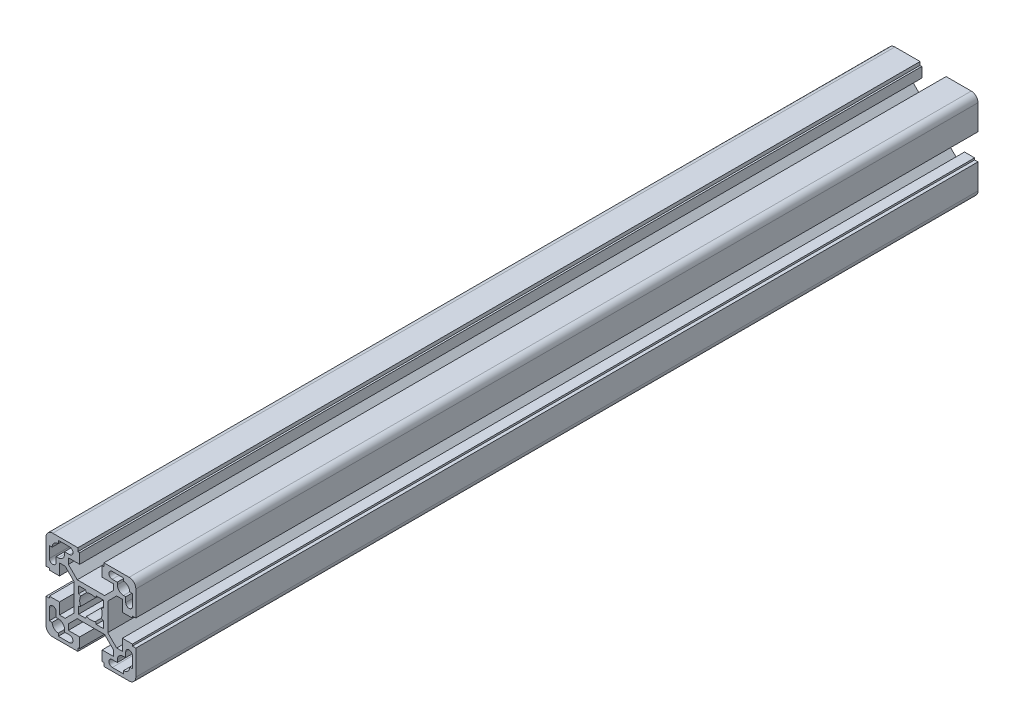
from build123d import *

# Parameters (mm, degrees)
EXTRUDE1_DEPTH = 375


with BuildPart() as part:
    # Sketch1 → Extrude1 (new body)
    with BuildSketch(Plane.XY):
        with BuildLine():
            Line((5.8, -20), (17, -20))
            ThreePointArc((17, -20), (19.121320344, -19.121320344), (20, -17))
            Line((20, -17), (20, -5.8))
            Line((20, -5.8), (18.5, -5.8))
            Line((18.5, -5.8), (18.5, -5))
            Line((18.5, -5), (14, -5))
            Line((14, -5), (14, -10.05))
            Line((14, -10.05), (11.464213562, -10.05))
            Line((11.464213562, -10.05), (7.5, -6.085786438))
            Line((7.5, -6.085786438), (7.5, 6.085786438))
            Line((7.5, 6.085786438), (11.464213562, 10.05))
            Line((11.464213562, 10.05), (14, 10.05))
            Line((14, 10.05), (14, 5))
            Line((14, 5), (18.5, 5))
            Line((18.5, 5), (18.5, 5.8))
            Line((18.5, 5.8), (20, 5.8))
            Line((20, 5.8), (20, 17))
            ThreePointArc((20, 17), (19.121320344, 19.121320344), (17, 20))
            Line((17, 20), (5.8, 20))
            Line((5.8, 20), (5.8, 18.5))
            Line((5.8, 18.5), (5, 18.5))
            Line((5, 18.5), (5, 14))
            Line((5, 14), (10.05, 14))
            Line((10.05, 14), (10.05, 11.464213562))
            Line((10.05, 11.464213562), (6.085786438, 7.5))
            Line((6.085786438, 7.5), (-6.085786438, 7.5))
            Line((-6.085786438, 7.5), (-10.05, 11.464213562))
            Line((-10.05, 11.464213562), (-10.05, 14))
            Line((-10.05, 14), (-5, 14))
            Line((-5, 14), (-5, 18.5))
            Line((-5, 18.5), (-5.8, 18.5))
            Line((-5.8, 18.5), (-5.8, 20))
            Line((-5.8, 20), (-17, 20))
            ThreePointArc((-17, 20), (-19.121320344, 19.121320344), (-20, 17))
            Line((-20, 17), (-20, 5.8))
            Line((-20, 5.8), (-18.5, 5.8))
            Line((-18.5, 5.8), (-18.5, 5))
            Line((-18.5, 5), (-14, 5))
            Line((-14, 5), (-14, 10.05))
            Line((-14, 10.05), (-11.464213562, 10.05))
            Line((-11.464213562, 10.05), (-7.5, 6.085786438))
            Line((-7.5, 6.085786438), (-7.5, -6.085786438))
            Line((-7.5, -6.085786438), (-11.464213562, -10.05))
            Line((-11.464213562, -10.05), (-14, -10.05))
            Line((-14, -10.05), (-14, -5))
            Line((-14, -5), (-18.5, -5))
            Line((-18.5, -5), (-18.5, -5.8))
            Line((-18.5, -5.8), (-20, -5.8))
            Line((-20, -5.8), (-20, -17))
            ThreePointArc((-20, -17), (-19.121320344, -19.121320344), (-17, -20))
            Line((-17, -20), (-5.8, -20))
            Line((-5.8, -20), (-5.8, -18.5))
            Line((-5.8, -18.5), (-5, -18.5))
            Line((-5, -18.5), (-5, -14))
            Line((-5, -14), (-10.05, -14))
            Line((-10.05, -14), (-10.05, -11.464213562))
            Line((-10.05, -11.464213562), (-6.085786438, -7.5))
            Line((-6.085786438, -7.5), (6.085786438, -7.5))
            Line((6.085786438, -7.5), (10.05, -11.464213562))
            Line((10.05, -11.464213562), (10.05, -14))
            Line((10.05, -14), (5, -14))
            Line((5, -14), (5, -18.5))
            Line((5, -18.5), (5.8, -18.5))
            Line((5.8, -18.5), (5.8, -20))
        make_face()
        with BuildLine():
            Line((14.5, -18.5), (9.5, -18.5))
            ThreePointArc((9.5, -18.5), (8, -17), (9.5, -15.5))
            Line((9.5, -15.5), (11.75, -15.5))
            Line((11.75, -15.5), (11.75, -14.5))
            ThreePointArc((11.75, -14.5), (12.555456352, -12.555456352), (14.5, -11.75))
            Line((14.5, -11.75), (15.5, -11.75))
            Line((15.5, -11.75), (15.5, -9.5))
            ThreePointArc((15.5, -9.5), (17, -8), (18.5, -9.5))
            Line((18.5, -9.5), (18.5, -14.5))
            Line((18.5, -14.5), (17.25, -14.5))
            ThreePointArc((17.25, -14.5), (16.444543648, -16.444543648), (14.5, -17.25))
            Line((14.5, -17.25), (14.5, -18.5))
        make_face(mode=Mode.SUBTRACT)
        with BuildLine():
            Line((18.5, 14.5), (17.25, 14.5))
            ThreePointArc((17.25, 14.5), (16.444543648, 16.444543648), (14.5, 17.25))
            Line((14.5, 17.25), (14.5, 18.5))
            Line((14.5, 18.5), (9.5, 18.5))
            ThreePointArc((9.5, 18.5), (8, 17), (9.5, 15.5))
            Line((9.5, 15.5), (11.75, 15.5))
            Line((11.75, 15.5), (11.75, 14.5))
            ThreePointArc((11.75, 14.5), (12.555456352, 12.555456352), (14.5, 11.75))
            Line((14.5, 11.75), (15.5, 11.75))
            Line((15.5, 11.75), (15.5, 9.5))
            ThreePointArc((15.5, 9.5), (17, 8), (18.5, 9.5))
            Line((18.5, 9.5), (18.5, 14.5))
        make_face(mode=Mode.SUBTRACT)
        with BuildLine():
            Line((5.5, 5.5), (2.397915762, 5.5))
            Line((2.397915762, 5.5), (1.998263135, 4.583333333))
            ThreePointArc((1.998263135, 4.583333333), (0, 5), (-1.998263135, 4.583333333))
            Line((-1.998263135, 4.583333333), (-2.397915762, 5.5))
            Line((-2.397915762, 5.5), (-5.5, 5.5))
            Line((-5.5, 5.5), (-5.5, 2.397915762))
            Line((-5.5, 2.397915762), (-4.583333333, 1.998263135))
            ThreePointArc((-4.583333333, 1.998263135), (-5, 0), (-4.583333333, -1.998263135))
            Line((-4.583333333, -1.998263135), (-5.5, -2.397915762))
            Line((-5.5, -2.397915762), (-5.5, -5.5))
            Line((-5.5, -5.5), (-2.397915762, -5.5))
            Line((-2.397915762, -5.5), (-1.998263135, -4.583333333))
            ThreePointArc((-1.998263135, -4.583333333), (0, -5), (1.998263135, -4.583333333))
            Line((1.998263135, -4.583333333), (2.397915762, -5.5))
            Line((2.397915762, -5.5), (5.5, -5.5))
            Line((5.5, -5.5), (5.5, -2.397915762))
            Line((5.5, -2.397915762), (4.583333333, -1.998263135))
            ThreePointArc((4.583333333, -1.998263135), (5, 0), (4.583333333, 1.998263135))
            Line((4.583333333, 1.998263135), (5.5, 2.397915762))
            Line((5.5, 2.397915762), (5.5, 5.5))
        make_face(mode=Mode.SUBTRACT)
        with BuildLine():
            Line((-18.5, -14.5), (-17.25, -14.5))
            ThreePointArc((-17.25, -14.5), (-16.444543648, -16.444543648), (-14.5, -17.25))
            Line((-14.5, -17.25), (-14.5, -18.5))
            Line((-14.5, -18.5), (-9.5, -18.5))
            ThreePointArc((-9.5, -18.5), (-8, -17), (-9.5, -15.5))
            Line((-9.5, -15.5), (-11.75, -15.5))
            Line((-11.75, -15.5), (-11.75, -14.5))
            ThreePointArc((-11.75, -14.5), (-12.555456352, -12.555456352), (-14.5, -11.75))
            Line((-14.5, -11.75), (-15.5, -11.75))
            Line((-15.5, -11.75), (-15.5, -9.5))
            ThreePointArc((-15.5, -9.5), (-17, -8), (-18.5, -9.5))
            Line((-18.5, -9.5), (-18.5, -14.5))
        make_face(mode=Mode.SUBTRACT)
        with BuildLine():
            Line((-14.5, 18.5), (-9.5, 18.5))
            ThreePointArc((-9.5, 18.5), (-8, 17), (-9.5, 15.5))
            Line((-9.5, 15.5), (-11.75, 15.5))
            Line((-11.75, 15.5), (-11.75, 14.5))
            ThreePointArc((-11.75, 14.5), (-12.555456352, 12.555456352), (-14.5, 11.75))
            Line((-14.5, 11.75), (-15.5, 11.75))
            Line((-15.5, 11.75), (-15.5, 9.5))
            ThreePointArc((-15.5, 9.5), (-17, 8), (-18.5, 9.5))
            Line((-18.5, 9.5), (-18.5, 14.5))
            Line((-18.5, 14.5), (-17.25, 14.5))
            ThreePointArc((-17.25, 14.5), (-16.444543648, 16.444543648), (-14.5, 17.25))
            Line((-14.5, 17.25), (-14.5, 18.5))
        make_face(mode=Mode.SUBTRACT)
    extrude(amount=EXTRUDE1_DEPTH)


solid = part.part
